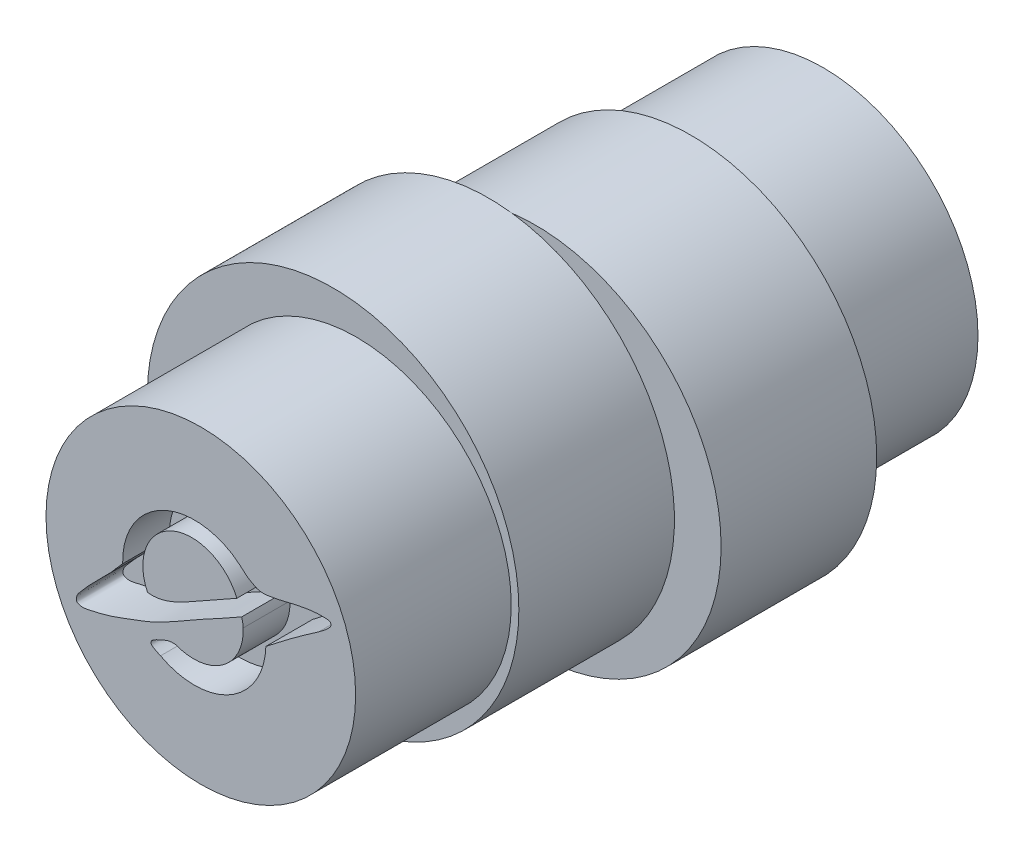
from build123d import *

# Parameters (mm, degrees)
SKETCH2_R           = 4.975
BOSS_EXTRUDE1_DEPTH = 5
SKETCH3_R           = 5.97
BOSS_EXTRUDE2_DEPTH = 5
SKETCH5_R           = 5.97
BOSS_EXTRUDE3_DEPTH = 5
SKETCH6_R           = 4.975
BOSS_EXTRUDE4_DEPTH = 5
SKETCH8_R           = 2.698107805
BOSS_EXTRUDE5_DEPTH = 4.6
CUT_EXTRUDE3_DEPTH  = 16.1
SKETCH12_R          = 2.646
CUT_EXTRUDE4_DEPTH  = 3
CUT_EXTRUDE5_DEPTH  = 1.5


with BuildPart() as part:
    # Sketch2 → Boss-Extrude1 (new body)
    with BuildSketch(Plane.XY.offset(10.054948089)):
        Circle(SKETCH2_R)
        with BuildLine():
            Line((2, 1.5), (2, -1.5))
            ThreePointArc((2, -1.5), (-2.5, 0), (2, 1.5))
        make_face(mode=Mode.SUBTRACT)
    extrude(amount=BOSS_EXTRUDE1_DEPTH)

    # Sketch3 → Boss-Extrude2 (add)
    with BuildSketch(Plane.XY.offset(15.054948089)):
        with Locations((0.75, 0)):
            Circle(SKETCH3_R)
        with BuildLine():
            Line((2, 1.5), (2, -1.5))
            ThreePointArc((2, -1.5), (-2.5, -1e-09), (2, 1.5))
        make_face(mode=Mode.SUBTRACT)
    extrude(amount=BOSS_EXTRUDE2_DEPTH)

    # Sketch5 → Boss-Extrude3 (add)
    with BuildSketch(Plane.XY.offset(20.054948089)):
        with Locations(Location((-0.75, 0, 0), (0, 0, 277.217031551))):
            Circle(SKETCH5_R)
        with BuildLine():
            Line((2, 1.5), (2, -1.5))
            ThreePointArc((2, -1.5), (-2.5, 0), (2, 1.5))
        make_face(mode=Mode.SUBTRACT)
    extrude(amount=BOSS_EXTRUDE3_DEPTH)

    # Sketch6 → Boss-Extrude4 (add)
    with BuildSketch(Plane.XY.offset(25.054948089)):
        Circle(SKETCH6_R)
        with BuildLine():
            Line((2, 1.5), (2, -1.5))
            ThreePointArc((2, -1.5), (-2.5, 0), (2, 1.5))
        make_face(mode=Mode.SUBTRACT)
    extrude(amount=BOSS_EXTRUDE4_DEPTH)

    # Sketch8 → Boss-Extrude5 (add)
    with BuildSketch(Plane.XY.offset(25.454948089)):
        Circle(SKETCH8_R)
    extrude(amount=BOSS_EXTRUDE5_DEPTH)

    # Sketch10 → Cut-Extrude3 (cut)
    with BuildSketch(Plane(origin=(0, 0, 10.054948089), x_dir=(-1, 0, 0), z_dir=(0, 0, -1))):
        with BuildLine():
            Line((-2.127176471, 1.57366968), (-2.127176471, -1.57366968))
            ThreePointArc((-2.127176471, -1.57366968), (2.646, 0), (-2.127176471, 1.57366968))
        make_face()
    extrude(amount=-CUT_EXTRUDE3_DEPTH, mode=Mode.SUBTRACT)

    # Sketch12 → Cut-Extrude4 (cut)
    with BuildSketch(Plane(origin=(0, 0, 10.054948089), x_dir=(-1, 0, 0), z_dir=(0, 0, -1))):
        Circle(SKETCH12_R)
    extrude(amount=-CUT_EXTRUDE4_DEPTH, mode=Mode.SUBTRACT)

    # Sketch13 → Cut-Extrude5 (cut)
    with BuildSketch(Plane.XY.offset(30.054948089)):
        with BuildLine():
            ThreePointArc((-2.51116552, -0.087954636), (-1.357302284, 1.973549468), (1.004944259, 1.942072291))
            add(Edge.make_bspline(
                [(1.004944259, 1.942072291), (1.080556299, 1.886286139), (1.19790515, 1.808024326), (1.373021318, 1.656234404), (1.47030803, 1.558406007), (1.550477263, 1.513006562)],
                knots=[0, 0, 0, 0, 0.406231217, 0.607035645, 1, 1, 1, 1], degree=3))
            add(Edge.make_bspline(
                [(1.550477263, 1.513006562), (1.635864774, 1.474239987), (1.773010843, 1.366273459), (2.039141531, 1.334356693), (2.331882187, 1.388131663), (2.66672311, 1.446751803), (2.982241637, 1.541137483), (3.279025568, 1.591865164), (3.523767348, 1.639570409), (3.784019221, 1.657387797), (3.969776334, 1.659661053), (4.168941475, 1.644062658), (4.202381272, 1.52843867), (4.126318671, 1.44725911), (4.010429706, 1.335902318), (3.968265182, 1.291154175), (3.792262006, 1.168081192)],
                knots=[0, 0, 0, 0, 0.086753896, 0.154448198, 0.238460485, 0.359650414, 0.46636505, 0.540243649, 0.635674639, 0.69606208, 0.776341506, 0.817536165, 0.854232706, 0.891997853, 0.906574583, 1, 1, 1, 1], degree=3))
            add(Edge.make_bspline(
                [(2.091354428, -0.087954636), (2.926147793, 0.575225687), (3.792262006, 1.168081192)],
                knots=[0, 0, 0, 1, 1, 1], degree=2))
            ThreePointArc((2.091354428, -0.087954636), (0.943093758, -2.009095653), (-1.294793502, -2.042948055))
            add(Edge.make_bspline(
                [(-1.294793502, -2.042948055), (-1.746909796, -1.848672711), (-1.711703775, -1.762613123), (-1.117517562, -1.523273653)],
                knots=[0, 0, 0, 0, 1, 1, 1, 1], degree=3))
            add(Edge.make_bspline(
                [(-1.117517562, -1.523273653), (-0.851635042, -1.433760086), (-0.637638887, -1.542714277)],
                knots=[0, 0, 0, 1, 1, 1], degree=2))
            ThreePointArc((-0.637638887, -1.542714277), (0.768418454, -1.247154446), (1.362404266, 0.061101538))
            add(Edge.make_bspline(
                [(1.362404266, 0.061101538), (1.355019388, 0.205736583), (1.311882289, 0.343336372)],
                knots=[0, 0, 0, 1, 1, 1], degree=2))
            add(Edge.make_bspline(
                [(1.311882289, 0.343336372), (1.271394274, 0.321666217), (0.98055525, 0.164223835), (0.484149511, -0.131008667), (-0.185861153, -0.47298164), (-0.847852238, -0.872955403), (-1.568325935, -1.264471006), (-2.337842685, -1.536065016), (-3.003283347, -1.787232277), (-3.502067412, -1.898250422), (-3.821928849, -1.960496005), (-4.017644788, -1.891018555), (-3.987917105, -1.67782918), (-3.819171551, -1.496110904), (-3.60958725, -1.238739607), (-3.341385255, -0.983372917), (-3.09159848, -0.713615899), (-2.794092314, -0.437511254), (-2.628823727, -0.204972872), (-2.51116552, -0.087954636)],
                knots=[0.23960858, 0.23960858, 0.23960858, 0.23960858, 0.252432001, 0.331936596, 0.400251659, 0.461905574, 0.547436375, 0.628008605, 0.68882094, 0.745646596, 0.769268725, 0.780800749, 0.795535828, 0.817809693, 0.851462573, 0.887178783, 0.921045432, 0.953843573, 1, 1, 1, 1], degree=3))
        make_face()
        with BuildLine():
            ThreePointArc((1.157395644, 0.783657031), (-0.928142572, 1.617548229), (-1.712921676, -0.486962626))
            add(Edge.make_bspline(
                [(-1.712921676, -0.486962626), (-1.384473336, -0.532536822), (-0.992466447, -0.411621309), (-0.517874245, -0.15891637)],
                knots=[0, 0, 0, 0, 1, 1, 1, 1], degree=3))
            add(Edge.make_bspline(
                [(-0.517874245, -0.15891637), (0.320919337, 0.310316941), (1.157395644, 0.783657031)],
                knots=[0, 0, 0, 1, 1, 1], degree=2))
        make_face(mode=Mode.SUBTRACT)
    extrude(amount=-CUT_EXTRUDE5_DEPTH, mode=Mode.SUBTRACT)


solid = part.part
